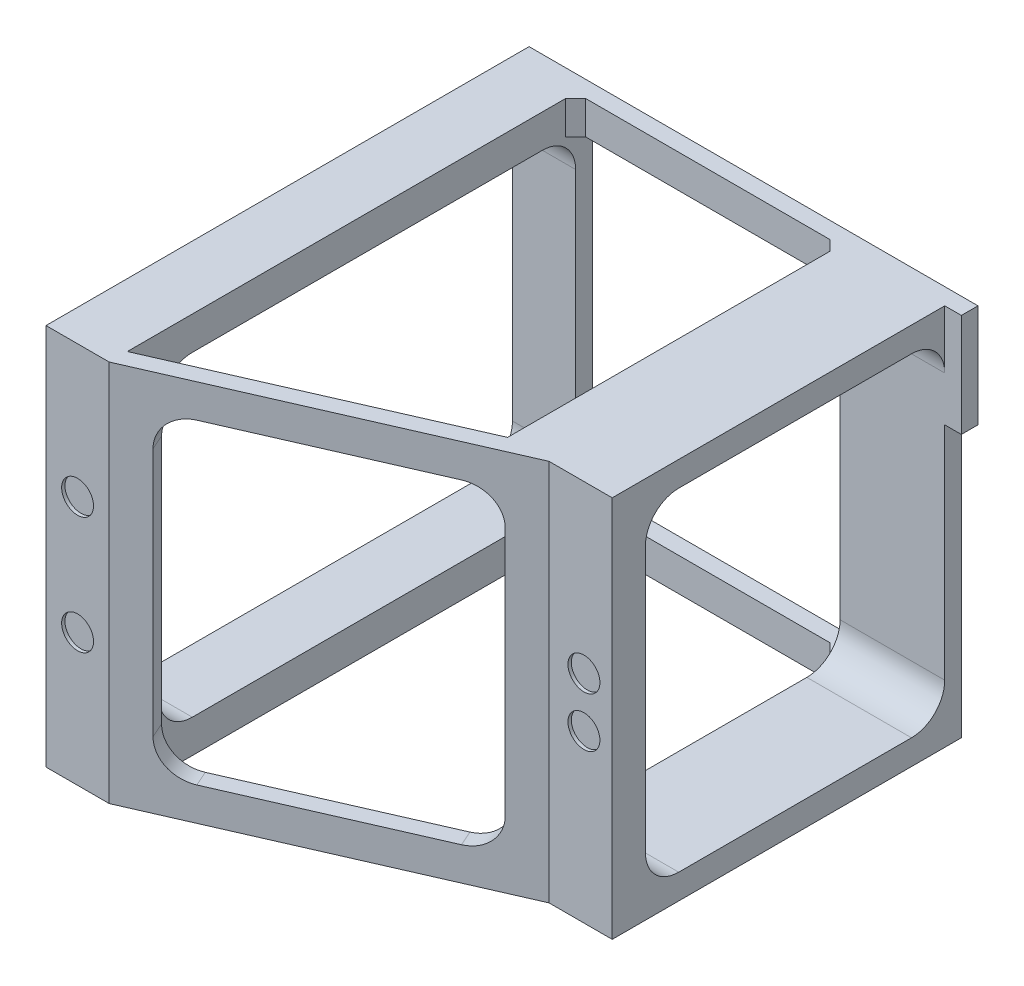
from build123d import *

# Parameters (mm, degrees)
SKETCH2_W           = 115
SKETCH2_H           = 130
SKETCH2_R           = 4.8
BOSS_EXTRUDE1_DEPTH = 5
BOSS_EXTRUDE2_DEPTH = 115
SKETCH4_W           = 98.530736165
SKETCH4_H           = 115
CUT_EXTRUDE1_DEPTH  = 5
SKETCH5_R           = 4.8
CUT_EXTRUDE2_DEPTH  = 1
SKETCH6_R           = 4.8
CUT_EXTRUDE4_DEPTH  = 1
SKETCH7_W           = 19
SKETCH7_H           = 115
BOSS_EXTRUDE3_DEPTH = 39.811986363
SKETCH8_W           = 19
SKETCH8_H           = 115
SKETCH8_W_2         = 31.469263835
BOSS_EXTRUDE4_DEPTH = 100
CUT_EXTRUDE5_DEPTH  = 19
CUT_EXTRUDE6_DEPTH  = 31.469263835
CUT_EXTRUDE7_DEPTH  = 5
SKETCH12_W          = 5
SKETCH12_H          = 10
BOSS_EXTRUDE5_DEPTH = 100
CHAMFER1_SIZE       = 3
SKETCH13_W          = 5
SKETCH13_H          = 31
BOSS_EXTRUDE6_DEPTH = 5


with BuildPart() as part:
    # Sketch2 → Boss-Extrude1 (new body)
    with BuildSketch(Plane(origin=(0, 0, 0), x_dir=(0, 1, 0), z_dir=(0, 0, 1))):
        Rectangle(SKETCH2_W, SKETCH2_H)
        with Locations(Location((-18.09, -55.5, 0), (0, 0, 270))):
            Circle(SKETCH2_R, mode=Mode.SUBTRACT)
        with Locations(Location((18.08, -55.5, 0), (0, 0, 270))):
            Circle(SKETCH2_R, mode=Mode.SUBTRACT)
    extrude(amount=BOSS_EXTRUDE1_DEPTH)

    # Sketch3 → Boss-Extrude2 (add)
    with BuildSketch(Plane(origin=(0, 57.5, 0), x_dir=(-1, 0, 0), z_dir=(0, 1, 0))):
        Polygon((-65, 5), (-46, 5), (46, 45.27), (65, 45.27), (65, 39.811986363), (46, 39.811986363), (-33.530736165, 5), (-33.530736165, 0), (-65, 0), align=None)
    extrude(amount=-BOSS_EXTRUDE2_DEPTH)

    # Sketch4 → Cut-Extrude1 (cut)
    with BuildSketch(Plane.XY.offset(5)):
        with Locations((-15.734631917, 0)):
            Rectangle(SKETCH4_W, SKETCH4_H)
    extrude(amount=-CUT_EXTRUDE1_DEPTH, mode=Mode.SUBTRACT)

    # Sketch5 → Cut-Extrude2 (cut)
    with BuildSketch(Plane.XY.offset(5)):
        with Locations((56.5, 7.5)):
            Circle(SKETCH5_R)
        with Locations((56.5, -7.5)):
            Circle(SKETCH5_R)
    extrude(amount=-CUT_EXTRUDE2_DEPTH, mode=Mode.SUBTRACT)

    # Sketch6 → Cut-Extrude4 (cut)
    with BuildSketch(Plane.XY.offset(45.27)):
        with Locations((-55.5, 17.65)):
            Circle(SKETCH6_R)
        with Locations((-55.5, -17.65)):
            Circle(SKETCH6_R)
    extrude(amount=-CUT_EXTRUDE4_DEPTH, mode=Mode.SUBTRACT)

    # Sketch7 → Boss-Extrude3 (add)
    with BuildSketch(Plane(origin=(0, 0, 39.811986363), x_dir=(1, 0, 0), z_dir=(0, 0, -1))):
        with Locations((-55.5, 0)):
            Rectangle(SKETCH7_W, SKETCH7_H)
    extrude(amount=BOSS_EXTRUDE3_DEPTH)

    # Sketch8 → Boss-Extrude4 (add)
    with BuildSketch(Plane(origin=(0, 0, 0), x_dir=(1, 0, 0), z_dir=(0, 0, -1))):
        with Locations((-55.5, 0)):
            Rectangle(SKETCH8_W, SKETCH8_H)
        with Locations((49.265368083, 0)):
            Rectangle(SKETCH8_W_2, SKETCH8_H)
    extrude(amount=BOSS_EXTRUDE4_DEPTH)

    # Sketch9 → Cut-Extrude5 (cut)
    with BuildSketch(Plane(origin=(-65, 0, 0), x_dir=(0, -1, 0), z_dir=(-1, 0, 0))):
        with BuildLine():
            Line((-37.5, -95), (37.5, -95))
            ThreePointArc((37.5, -95), (44.571067812, -92.071067812), (47.5, -85))
            Line((47.5, -85), (47.5, 20.27))
            ThreePointArc((47.5, 20.27), (44.571067812, 27.341067812), (37.5, 30.27))
            Line((37.5, 30.27), (-37.5, 30.27))
            ThreePointArc((-37.5, 30.27), (-44.571067812, 27.341067812), (-47.5, 20.27))
            Line((-47.5, 20.27), (-47.5, -85))
            ThreePointArc((-47.5, -85), (-44.571067812, -92.071067812), (-37.5, -95))
        make_face()
    extrude(amount=-CUT_EXTRUDE5_DEPTH, mode=Mode.SUBTRACT)

    # Sketch10 → Cut-Extrude6 (cut)
    with BuildSketch(Plane.YZ.offset(65)):
        with BuildLine():
            Line((-40, -95), (40, -95))
            ThreePointArc((40, -95), (47.071067812, -92.071067812), (50, -85))
            Line((50, -85), (50, -15))
            ThreePointArc((50, -15), (47.071067812, -7.928932188), (40, -5))
            Line((40, -5), (-40, -5))
            ThreePointArc((-40, -5), (-47.071067812, -7.928932188), (-50, -15))
            Line((-50, -15), (-50, -85))
            ThreePointArc((-50, -85), (-47.071067812, -92.071067812), (-40, -95))
        make_face()
    extrude(amount=-CUT_EXTRUDE6_DEPTH, mode=Mode.SUBTRACT)

    # Sketch11 → Cut-Extrude7 (cut)
    with BuildSketch(Plane(origin=(9.233013436, 0, 21.093549445), x_dir=(0.9160841896254345, 0, -0.4009859816980028), z_dir=(0.4009859816980028, 0, 0.9160841896254345))):
        with BuildLine():
            Line((-40.292508114, 47.5), (20.134942814, 47.5))
            ThreePointArc((20.134942814, 47.5), (27.206010626, 44.571067812), (30.134942814, 37.5))
            Line((30.134942814, 37.5), (30.134942814, -37.5))
            ThreePointArc((30.134942814, -37.5), (27.206010626, -44.571067812), (20.134942814, -47.5))
            Line((20.134942814, -47.5), (-40.292508114, -47.5))
            ThreePointArc((-40.292508114, -47.5), (-47.363575926, -44.571067812), (-50.292508114, -37.5))
            Line((-50.292508114, -37.5), (-50.292508114, 37.5))
            ThreePointArc((-50.292508114, 37.5), (-47.363575926, 44.571067812), (-40.292508114, 47.5))
        make_face()
    extrude(amount=-CUT_EXTRUDE7_DEPTH, mode=Mode.SUBTRACT)

    # Sketch12 → Boss-Extrude5 (add)
    with BuildSketch(Plane.ZY.offset(65)):
        with Locations((-97.5, 52.5)):
            Rectangle(SKETCH12_W, SKETCH12_H)
        with Locations((-97.5, -52.5)):
            Rectangle(SKETCH12_W, SKETCH12_H)
    extrude(amount=-BOSS_EXTRUDE5_DEPTH)

    # Chamfer1
    chamfer1_edges = [part.edges().sort_by_distance(p)[0] for p in [
        (-46, 52.5, -95),
        (33.530736165, 52.5, -95),
        (-46, -52.5, -95),
        (33.530736165, -52.5, -95),
    ]]
    chamfer(chamfer1_edges, length=CHAMFER1_SIZE)

    # Sketch13 → Boss-Extrude6 (add)
    with BuildSketch(Plane(origin=(65, 0, 0), x_dir=(0, 0, -1), z_dir=(1, 0, 0))):
        with Locations((97.5, 42)):
            Rectangle(SKETCH13_W, SKETCH13_H)
    extrude(amount=BOSS_EXTRUDE6_DEPTH)


solid = part.part
